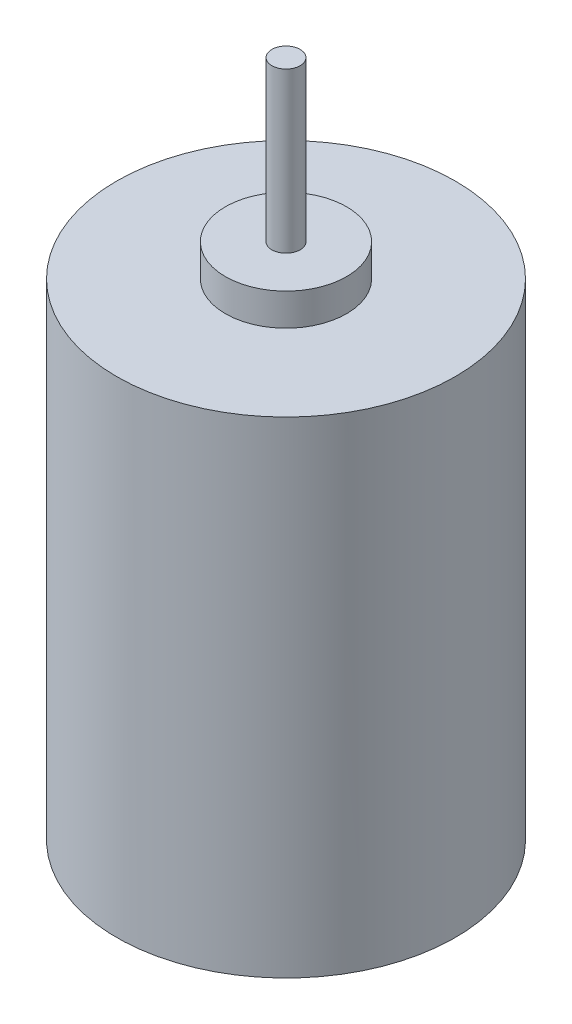
from build123d import *

# Parameters (mm, degrees)
SKETCH2_R           = 13.700000032
BOSS_EXTRUDE1_DEPTH = 57.000000046
SKETCH15_OUTSIDE_W  = 43.184
SKETCH15_OUTSIDE_H  = 43.184
SKETCH15_OUTSIDE_R  = 1.143
CUT_EXTRUDE10_DEPTH = 12.900000108
SKETCH18_OUTSIDE_W  = 43.184
SKETCH18_OUTSIDE_H  = 43.184
SKETCH18_OUTSIDE_R  = 4.899999979
CUT_EXTRUDE13_DEPTH = 2.600000134
SKETCH21_OUTSIDE_W  = 43.184
SKETCH21_OUTSIDE_H  = 43.184
SKETCH21_OUTSIDE_R  = 1.099999959
CUT_EXTRUDE16_DEPTH = 1.299999686
SKETCH23_OUTSIDE_W  = 43.184
SKETCH23_OUTSIDE_H  = 43.184
SKETCH23_OUTSIDE_R  = 4.899999979
CUT_EXTRUDE18_DEPTH = 2.200000172


with BuildPart() as part:
    # Sketch2 → Boss-Extrude1 (new body)
    with BuildSketch(Plane(origin=(0, 0, 0), x_dir=(1, 0, 0), z_dir=(0, 1, 0))):
        with Locations(Location((0, 0, 0), (0, 0, 270))):
            Circle(SKETCH2_R)
    extrude(amount=BOSS_EXTRUDE1_DEPTH)

    # Sketch15 outside → Cut-Extrude10 (cut)
    with BuildSketch(Plane(origin=(0, 57.000000046, 0), x_dir=(1, 0, 0), z_dir=(0, 1, 0))):
        Rectangle(SKETCH15_OUTSIDE_W, SKETCH15_OUTSIDE_H)
        with Locations(Location((0, 0, 0), (0, 0, 270))):
            Circle(SKETCH15_OUTSIDE_R, mode=Mode.SUBTRACT)
    extrude(amount=-CUT_EXTRUDE10_DEPTH, mode=Mode.SUBTRACT)

    # Sketch18 outside → Cut-Extrude13 (cut)
    with BuildSketch(Plane(origin=(0, 44.099999938, 0), x_dir=(1, 0, 0), z_dir=(0, 1, 0))):
        Rectangle(SKETCH18_OUTSIDE_W, SKETCH18_OUTSIDE_H)
        with Locations(Location((0, 0, 0), (0, 0, 270))):
            Circle(SKETCH18_OUTSIDE_R, mode=Mode.SUBTRACT)
    extrude(amount=-CUT_EXTRUDE13_DEPTH, mode=Mode.SUBTRACT)

    # Sketch21 outside → Cut-Extrude16 (cut)
    with BuildSketch(Plane(origin=(0, 0, 0), x_dir=(-1, 0, 0), z_dir=(0, -1, 0))):
        Rectangle(SKETCH21_OUTSIDE_W, SKETCH21_OUTSIDE_H)
        with Locations(Location((0, 0, 0), (0, 0, 90))):
            Circle(SKETCH21_OUTSIDE_R, mode=Mode.SUBTRACT)
    extrude(amount=-CUT_EXTRUDE16_DEPTH, mode=Mode.SUBTRACT)

    # Sketch23 outside → Cut-Extrude18 (cut)
    with BuildSketch(Plane.XZ):
        Rectangle(SKETCH23_OUTSIDE_W, SKETCH23_OUTSIDE_H)
        with Locations(Location((0, 0, 0), (0, 0, 90))):
            Circle(SKETCH23_OUTSIDE_R, mode=Mode.SUBTRACT)
    extrude(amount=-CUT_EXTRUDE18_DEPTH, mode=Mode.SUBTRACT)


solid = part.part
